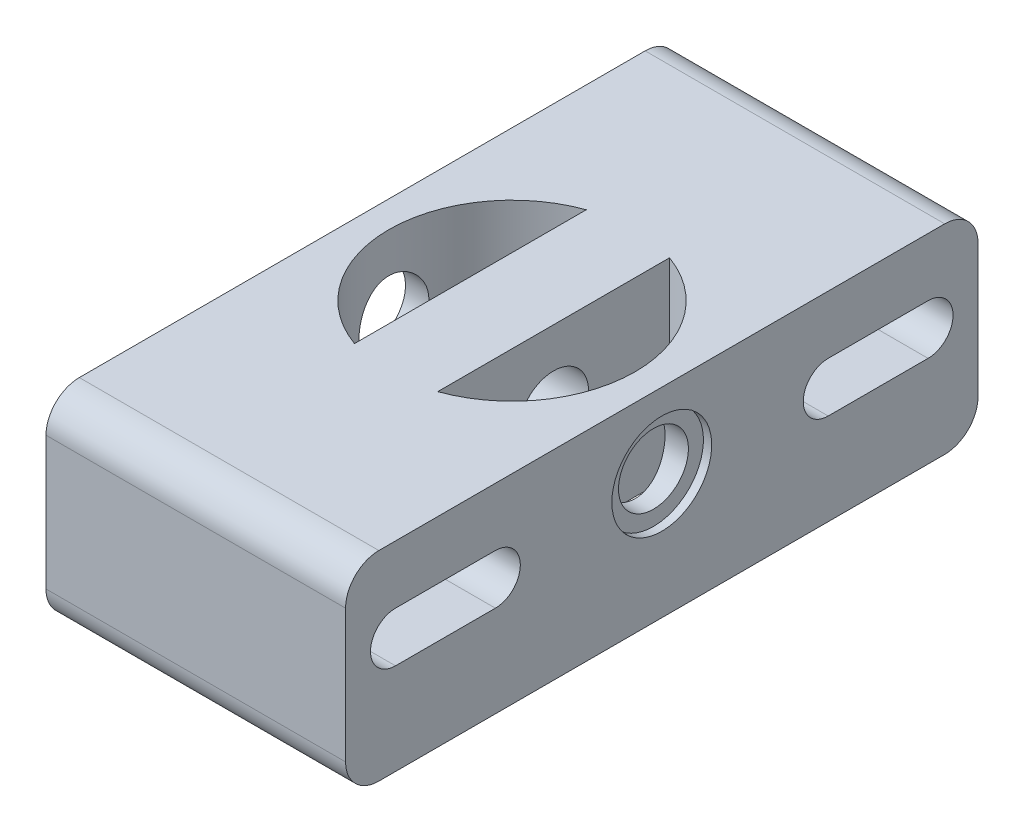
from build123d import *

# Parameters (mm, degrees)
SKETCH_1_W          = 18
SKETCH_1_H          = 38
EXTRUDE_1_DEPTH     = 12
SKETCH_2_R          = 2.1
CUT_EXTRUDE_1_DEPTH = 29.792360098
SKETCH_3_R          = 3
CUT_EXTRUDE_2_DEPTH = 0.5
CUT_EXTRUDE_3_DEPTH = 29.792360139
FILLET_1_R          = 2
CHAMFER_1_SIZE      = 0.6


with BuildPart() as part:
    # 草图1 → 凸台-拉伸1 (new body)
    with BuildSketch(Plane(origin=(0, 0, 0), x_dir=(1, 0, 0), z_dir=(0, 1, 0))):
        Rectangle(SKETCH_1_W, SKETCH_1_H)
        with BuildLine():
            Line((2.5, 6.96491206), (2.5, -6.96491206))
            ThreePointArc((2.5, -6.96491206), (7.4, 0), (2.5, 6.96491206))
        make_face(mode=Mode.SUBTRACT)
        with BuildLine():
            Line((-2.5, 6.96491206), (-2.5, -6.96491206))
            ThreePointArc((-2.5, -6.96491206), (-7.4, 0), (-2.5, 6.96491206))
        make_face(mode=Mode.SUBTRACT)
    extrude(amount=EXTRUDE_1_DEPTH)

    # 草图2 → 切除-拉伸1 (cut, through all)
    with BuildSketch(Plane.ZY.offset(9)):
        with Locations((0, 7.5)):
            Circle(SKETCH_2_R)
    extrude(amount=-CUT_EXTRUDE_1_DEPTH, mode=Mode.SUBTRACT)

    # 草图3 → 切除-拉伸2 (cut)
    with BuildSketch(Plane.ZY.offset(9)):
        with Locations((0, 7.5)):
            Circle(SKETCH_3_R)
    cut_extrude_2 = extrude(amount=-CUT_EXTRUDE_2_DEPTH, mode=Mode.SUBTRACT)

    # 镜向1: 切除-拉伸2 across plane
    add(cut_extrude_2.mirror(Plane(origin=(0, 0, 0), x_dir=(0, 0, 1), z_dir=(1, 0, 0))), mode=Mode.SUBTRACT)

    # 草图4 → 切除-拉伸3 (cut, through all)
    with BuildSketch(Plane.ZY.offset(9)):
        with BuildLine():
            Line((-16, 8.5), (-10, 8.5))
            ThreePointArc((-10, 8.5), (-8.5, 7), (-10, 5.5))
            Line((-10, 5.5), (-16, 5.5))
            ThreePointArc((-16, 5.5), (-17.5, 7), (-16, 8.5))
        make_face()
        with BuildLine():
            Line((10, 5.5), (16, 5.5))
            ThreePointArc((16, 5.5), (17.5, 7), (16, 8.5))
            Line((16, 8.5), (10, 8.5))
            ThreePointArc((10, 8.5), (8.5, 7), (10, 5.5))
        make_face()
    extrude(amount=-CUT_EXTRUDE_3_DEPTH, mode=Mode.SUBTRACT)

    # 圆角1
    fillet_1_edges = [part.edges().sort_by_distance(p)[0] for p in [
        (0, 12, 19),
        (0, 0, 19),
        (0, 0, -19),
        (0, 12, -19),
    ]]
    fillet(fillet_1_edges, radius=FILLET_1_R)

    # 倒角1
    chamfer_1_edges = [part.edges().sort_by_distance(p)[0] for p in [
        (7.4, 0, 0),
        (2.5, 0, 0),
        (-7.4, 0, 0),
        (-2.5, 0, 0),
    ]]
    chamfer(chamfer_1_edges, length=CHAMFER_1_SIZE)


solid = part.part
